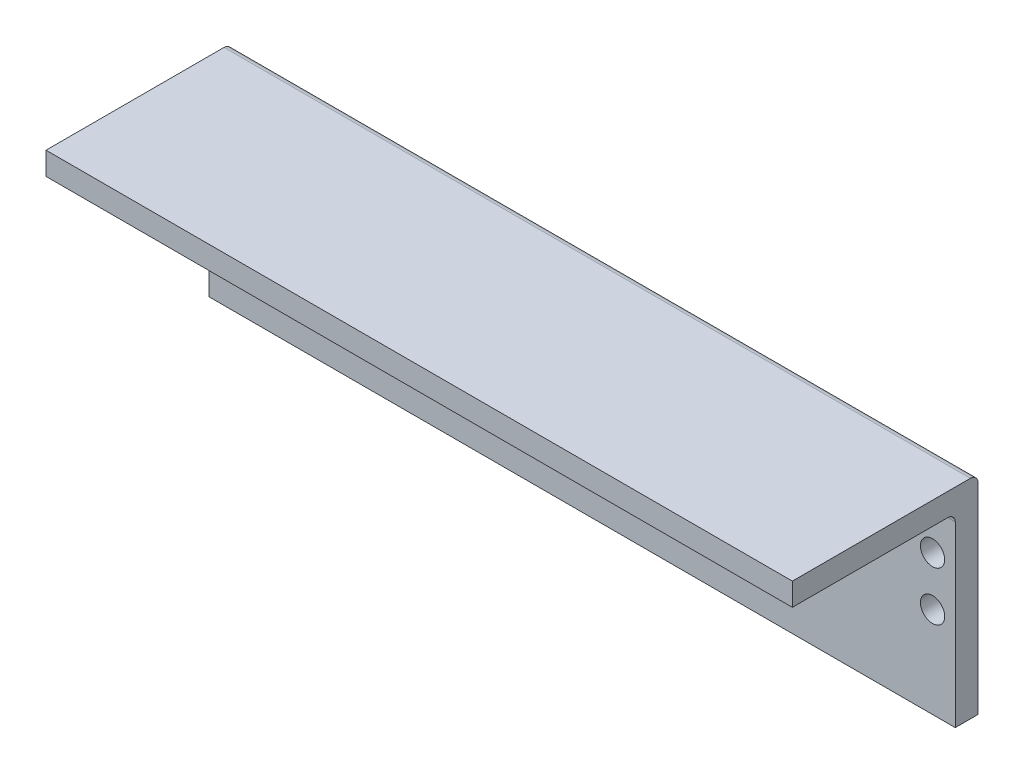
from build123d import *

# Parameters (mm, degrees)
SKETCH_1_W      = 98.5
SKETCH_1_H      = 18.5
SKETCH_1_R      = 1.6
EXTRUDE_1_DEPTH = 3
SKETCH_2_W      = 98.5
SKETCH_2_H      = 21.5
EXTRUDE_2_DEPTH = 3
FILLET_1_R      = 1
SKETCH_3_W      = 98.5
SKETCH_3_H      = 3
EXTRUDE_3_DEPTH = 9


with BuildPart() as part:
    # 草图1 → 凸台-拉伸1 (new body)
    with BuildSketch(Plane.XY):
        with Locations((0, 9.25)):
            Rectangle(SKETCH_1_W, SKETCH_1_H)
        with Locations((-46.25, 3)):
            Circle(SKETCH_1_R, mode=Mode.SUBTRACT)
        with Locations((-46.25, 9.5)):
            Circle(SKETCH_1_R, mode=Mode.SUBTRACT)
        with Locations((46.25, 3)):
            Circle(SKETCH_1_R, mode=Mode.SUBTRACT)
        with Locations((46.25, 9.5)):
            Circle(SKETCH_1_R, mode=Mode.SUBTRACT)
    extrude(amount=EXTRUDE_1_DEPTH)

    # 草图2 → 凸台-拉伸2 (add)
    with BuildSketch(Plane(origin=(0, 18.5, 0), x_dir=(1, 0, 0), z_dir=(0, 1, 0))):
        with Locations((0, -13.75)):
            Rectangle(SKETCH_2_W, SKETCH_2_H)
    extrude(amount=-EXTRUDE_2_DEPTH)

    # 圆角1
    fillet_1_edges = [part.edges().sort_by_distance(p)[0] for p in [
        (0, 15.5, 3),
        (0, 18.5, 0),
    ]]
    fillet(fillet_1_edges, radius=FILLET_1_R)

    # 草图3 → 凸台-拉伸3 (add)
    with BuildSketch(Plane.XZ):
        with Locations((0, 1.5)):
            Rectangle(SKETCH_3_W, SKETCH_3_H)
    extrude(amount=EXTRUDE_3_DEPTH)


solid = part.part
